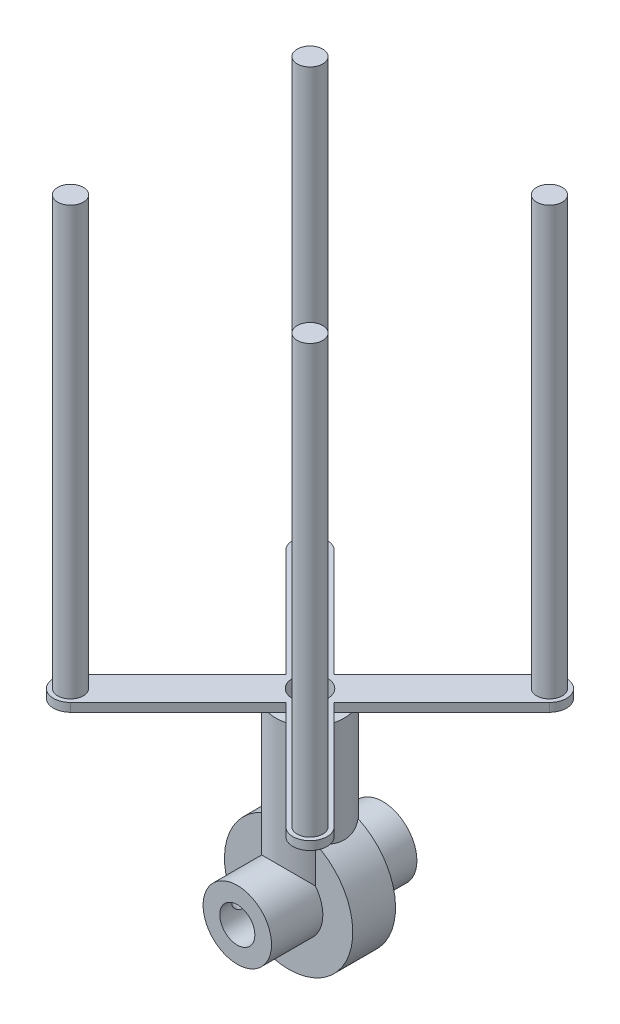
from build123d import *
from build123d.topology import SkipClean

# Parameters (mm, degrees)
SKETCH1_R                           = 7.5
SKETCH1_R_2                         = 2.05
BOSS_EXTRUDE1_DEPTH                 = 2.5
SKETCH2_R                           = 4
SKETCH2_R_2                         = 2.05
BOSS_EXTRUDE2_DEPTH                 = 6
SKETCH7_W                           = 4
SKETCH7_H                           = 18.687164731
REVOLVE7_ANGLE                      = 180
SKETCH8_W                           = 2.05
SKETCH8_H                           = 18.687164731
SKETCH9_R                           = 2.05
CUT_EXTRUDE1_DEPTH                  = 5
BOSS_EXTRUDE3_START                 = 1
SKETCH10_R                          = 2.05
BOSS_EXTRUDE3_DEPTH                 = 1
SKETCH11_R                          = 1.5
BOSS_EXTRUDE4_DEPTH                 = 50
M3X0_5_TAPPED_HOLE1_REACH           = 76.406
M3X0_5_TAPPED_HOLE1_BORE_R          = 1.25
M3X0_5_TAPPED_HOLE1_ON_FACE_2_REACH = 76.436
M3X0_5_TAPPED_HOLE1_BORE_2_R        = 1.25


with BuildPart() as part:
    # Sketch1 → Boss-Extrude1 (new body)
    with BuildSketch(Plane.XY):
        with Locations((102.341205301, 36.416113389)):
            Circle(SKETCH1_R)
        with Locations((102.341205301, 36.416113389)):
            Circle(SKETCH1_R_2, mode=Mode.SUBTRACT)
    boss_extrude1 = extrude(amount=BOSS_EXTRUDE1_DEPTH)

    # Sketch2 → Boss-Extrude2 (add)
    with BuildSketch(Plane.XY.offset(2.5)):
        with Locations((102.341205301, 36.416113389)):
            Circle(SKETCH2_R)
        with Locations((102.341205301, 36.416113389)):
            Circle(SKETCH2_R_2, mode=Mode.SUBTRACT)
    boss_extrude2 = extrude(amount=BOSS_EXTRUDE2_DEPTH)

    # Sketch7 → Revolve7 (revolve)
    with BuildSketch(Plane(origin=(0, 0, 0), x_dir=(-1, 0, 0), z_dir=(0, 0, -1))):
        with Locations((-104.341205301, 45.759695755)):
            Rectangle(SKETCH7_W, SKETCH7_H)
    revolve7 = revolve(axis=Axis((102.341205301, 36.416113389, 0), (0, -1, 0)), revolution_arc=REVOLVE7_ANGLE)

    # Sketch8 → Cut-Revolve2 (revolve, cut)
    with BuildSketch(Plane(origin=(0, 0, 0), x_dir=(-1, 0, 0), z_dir=(0, 0, -1))):
        with Locations((-103.366205301, 45.759695755)):
            Rectangle(SKETCH8_W, SKETCH8_H)
    cut_revolve2 = revolve(axis=Axis((102.341205301, 36.416113389, 0), (0, 1, 0)), mode=Mode.SUBTRACT)

    # Sketch9 → Cut-Extrude1 (cut)
    with SkipClean():  # the faces are left unmerged after this step: merging them gives an invalid solid
        with BuildSketch(Plane(origin=(0, 0, 0), x_dir=(-1, 0, 0), z_dir=(0, 0, -1))):
            with Locations(Location((-102.341205301, 36.416113389, 0), (0, 0, 180))):
                Circle(SKETCH9_R)
        cut_extrude1 = extrude(amount=-CUT_EXTRUDE1_DEPTH, mode=Mode.SUBTRACT)

    # Mirror1: Boss-Extrude1, Boss-Extrude2, Revolve7, Cut-Revolve2, Cut-Extrude1 across plane
    with SkipClean():  # the faces are left unmerged after this step: merging them gives an invalid solid
        add(boss_extrude1.mirror(Plane(origin=(102.341205301, 36.416113389, 0), x_dir=(1, 0, 0), z_dir=(0, 0, 1))))
        add(boss_extrude2.mirror(Plane(origin=(102.341205301, 36.416113389, 0), x_dir=(1, 0, 0), z_dir=(0, 0, 1))))
        add(revolve7.mirror(Plane(origin=(102.341205301, 36.416113389, 0), x_dir=(1, 0, 0), z_dir=(0, 0, 1))))
        add(cut_revolve2.mirror(Plane(origin=(102.341205301, 36.416113389, 0), x_dir=(1, 0, 0), z_dir=(0, 0, 1))), mode=Mode.SUBTRACT)
        add(cut_extrude1.mirror(Plane(origin=(102.341205301, 36.416113389, 0), x_dir=(1, 0, 0), z_dir=(0, 0, 1))), mode=Mode.SUBTRACT)

    # Sketch10 → Boss-Extrude3 (add)
    with BuildSketch(Plane(origin=(0, 55.10327812, 0), x_dir=(1, 0, 0), z_dir=(0, 1, 0)).offset(BOSS_EXTRUDE3_START)):
        with BuildLine():
            Line((102.341205301, 2.828427125), (89.755418863, 15.414213562))
            ThreePointArc((89.755418863, 15.414213562), (86.926991738, 15.414213562), (86.926991738, 12.585786438))
            Line((86.926991738, 12.585786438), (99.512778176, 0))
            Line((99.512778176, 0), (86.926991738, -12.585786438))
            ThreePointArc((86.926991738, -12.585786438), (86.926991738, -15.414213562), (89.755418863, -15.414213562))
            Line((89.755418863, -15.414213562), (102.341205301, -2.828427125))
            Line((102.341205301, -2.828427125), (114.926991738, -15.414213562))
            ThreePointArc((114.926991738, -15.414213562), (117.755418863, -15.414213562), (117.755418863, -12.585786438))
            Line((117.755418863, -12.585786438), (105.169632425, 0))
            Line((105.169632425, 0), (117.755418863, 12.585786438))
            ThreePointArc((117.755418863, 12.585786438), (117.755418863, 15.414213562), (114.926991738, 15.414213562))
            Line((114.926991738, 15.414213562), (102.341205301, 2.828427125))
        make_face()
        with Locations(Location((102.341205301, 0, 0), (0, 0, 180))):
            Circle(SKETCH10_R, mode=Mode.SUBTRACT)
    extrude(amount=-BOSS_EXTRUDE3_DEPTH)

    # Sketch11 → Boss-Extrude4 (add)
    with BuildSketch(Plane(origin=(0, 56.10327812, 0), x_dir=(1, 0, 0), z_dir=(0, 1, 0))):
        with Locations(Location((88.341205301, 14, 0), (0, 0, 270))):
            Circle(SKETCH11_R)
        with Locations(Location((116.341205301, 14, 0), (0, 0, 270))):
            Circle(SKETCH11_R)
        with Locations(Location((116.341205301, -14, 0), (0, 0, 270))):
            Circle(SKETCH11_R)
        with Locations(Location((88.341205301, -14, 0), (0, 0, 270))):
            Circle(SKETCH11_R)
    extrude(amount=BOSS_EXTRUDE4_DEPTH)

    # M3x0.5 Tapped Hole1 bore (on position points) → M3x0.5 Tapped Hole1 (cut, up to next)
    with BuildSketch(Plane(origin=(98.587954415, 37.799264786, 5.923678009), x_dir=(-0.345787849288, -0.938312721477, 0), z_dir=(-0.938312721477, 0.345787849288, 0)), mode=Mode.PRIVATE) as m3x0_5_tapped_hole1_sk1:
        Circle(M3X0_5_TAPPED_HOLE1_BORE_R)
    m3x0_5_tapped_hole1_tool1 = extrude(m3x0_5_tapped_hole1_sk1.sketch, amount=-M3X0_5_TAPPED_HOLE1_REACH, mode=Mode.PRIVATE) & part.part
    add(m3x0_5_tapped_hole1_tool1.solids().sort_by_distance((98.587954, 37.799265, 5.923678))[0], mode=Mode.SUBTRACT)

    # M3x0.5 Tapped Hole1 bore 2 (on position points) → M3x0.5 Tapped Hole1 on face 2 (cut, up to next)
    with BuildSketch(Plane(origin=(98.537036141, 37.652356489, -5.51866452), x_dir=(-0.309061063746, -0.95104219616, 0), z_dir=(-0.95104219616, 0.309061063746, 0)), mode=Mode.PRIVATE) as m3x0_5_tapped_hole1_on_face_2_sk1:
        Circle(M3X0_5_TAPPED_HOLE1_BORE_2_R)
    m3x0_5_tapped_hole1_on_face_2_tool1 = extrude(m3x0_5_tapped_hole1_on_face_2_sk1.sketch, amount=-M3X0_5_TAPPED_HOLE1_ON_FACE_2_REACH, mode=Mode.PRIVATE) & part.part
    add(m3x0_5_tapped_hole1_on_face_2_tool1.solids().sort_by_distance((98.537036, 37.652356, -5.518665))[0], mode=Mode.SUBTRACT)


solid = part.part
